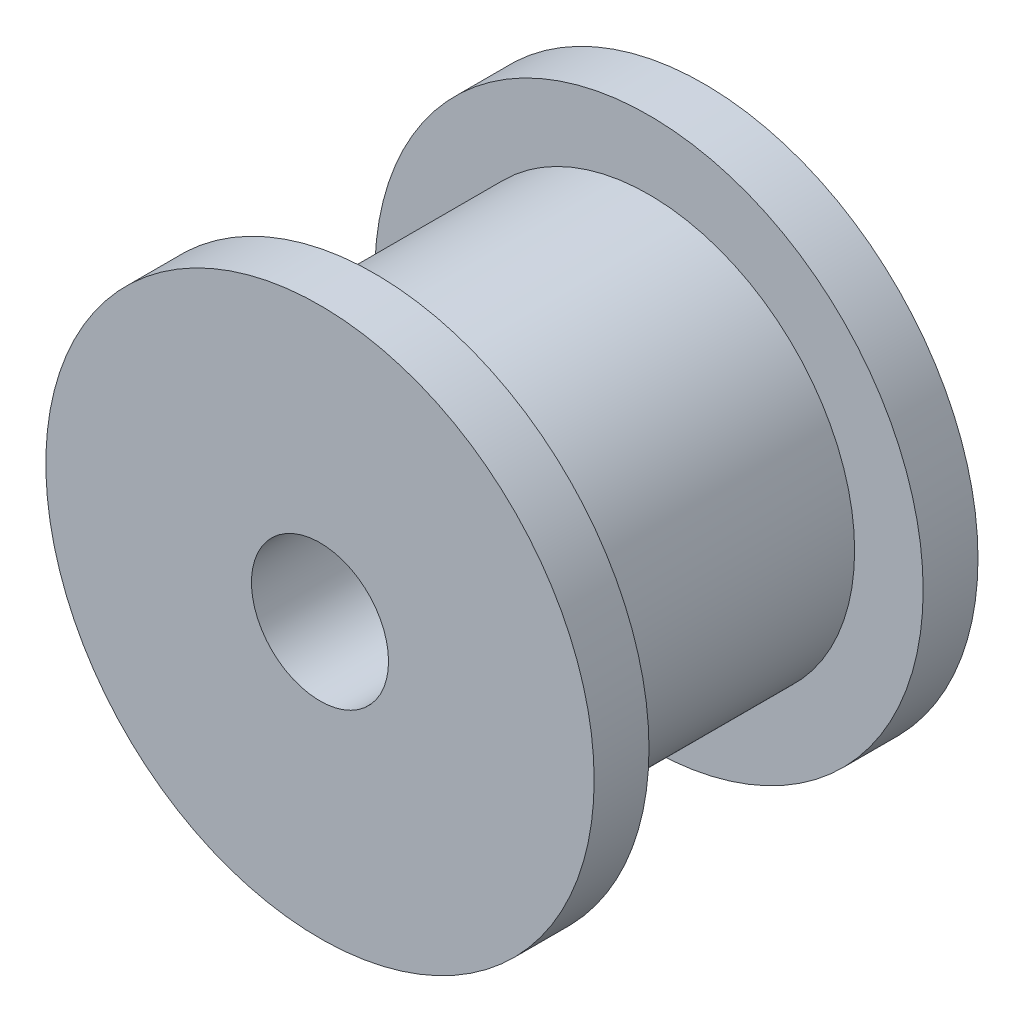
from build123d import *

# Parameters (mm, degrees)
SKETCH1_R           = 10
BOSS_EXTRUDE1_DEPTH = 7
SKETCH2_R           = 10
SKETCH2_R_2         = 7.5
CUT_EXTRUDE2_DEPTH  = 5
CUT_EXTRUDE3_REACH  = 21.9
SKETCH3_R           = 2.5


with BuildPart() as part:
    # Sketch1 → Boss-Extrude1 (new, symmetric)
    with BuildSketch(Plane.XY):
        Circle(SKETCH1_R)
    extrude(amount=BOSS_EXTRUDE1_DEPTH, both=True)

    # Sketch2 → Cut-Extrude2 (cut, symmetric)
    with BuildSketch(Plane.XY):
        Circle(SKETCH2_R)
        Circle(SKETCH2_R_2, mode=Mode.SUBTRACT)
    extrude(amount=CUT_EXTRUDE2_DEPTH, both=True, mode=Mode.SUBTRACT)

    # Sketch3 → Cut-Extrude3 (cut, up to next)
    with BuildSketch(Plane.XY.offset(7), mode=Mode.PRIVATE) as cut_extrude3_sk1:
        Circle(SKETCH3_R)
    cut_extrude3_tool1 = extrude(cut_extrude3_sk1.sketch, amount=-CUT_EXTRUDE3_REACH, mode=Mode.PRIVATE) & part.part
    add(cut_extrude3_tool1.solids().sort_by_distance((0, 0, 7))[0], mode=Mode.SUBTRACT)


solid = part.part
